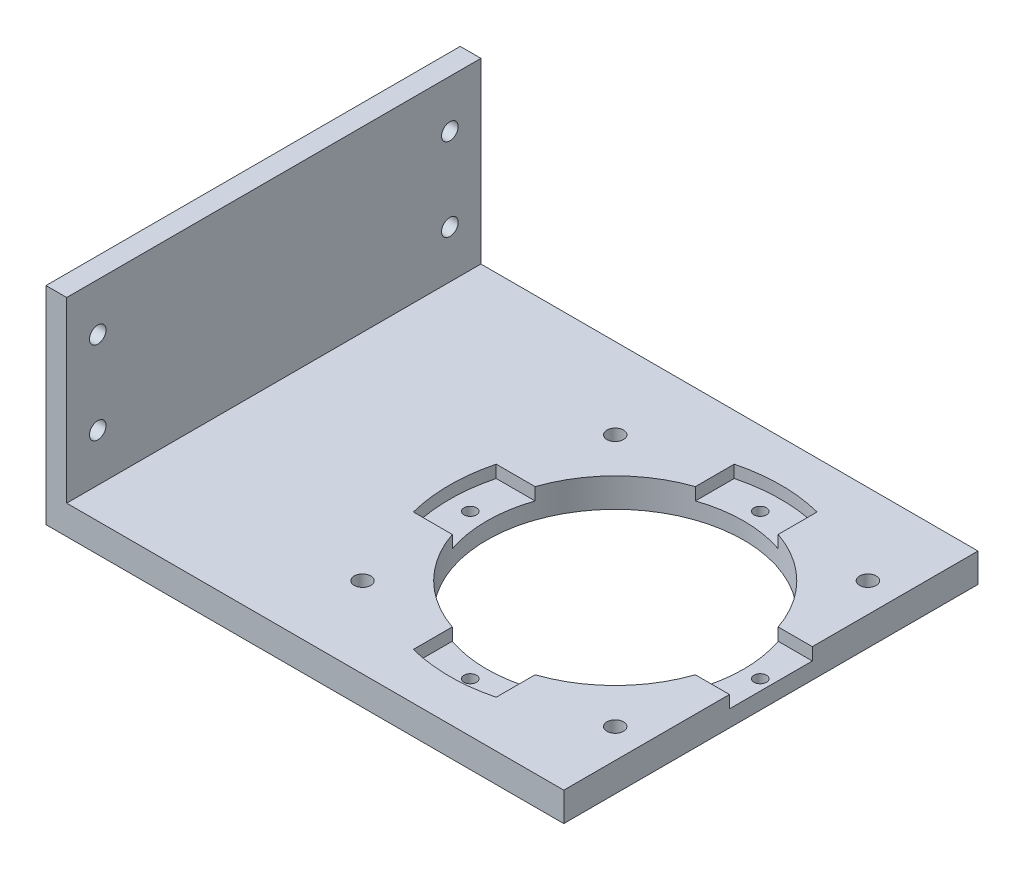
from build123d import *

# Parameters (mm, degrees)
BOSS_EXTRUDE1_DEPTH = 100
CUT_EXTRUDE1_REACH  = 167.753
SKETCH2_R           = 31
SKETCH2_R_2         = 2
CUT_EXTRUDE2_REACH  = 166.012
SKETCH3_R           = 2
CUT_EXTRUDE3_DEPTH  = 3
CUT_EXTRUDE4_REACH  = 168.556
SKETCH6_R           = 1.5


with BuildPart() as part:
    # Sketch1 → Boss-Extrude1 (new body)
    with BuildSketch(Plane.XY):
        Polygon((0, 0), (125, 0), (125, 7), (5, 7), (5, 50), (0, 50), align=None)
    extrude(amount=BOSS_EXTRUDE1_DEPTH)

    # Sketch2 → Cut-Extrude1 (cut, up to next)
    with BuildSketch(Plane(origin=(0, 7, 0), x_dir=(1, 0, 0), z_dir=(0, 1, 0)), mode=Mode.PRIVATE) as cut_extrude1_sk1:
        with Locations(Location((87.42, -50, 0), (0, 0, 180))):
            Circle(SKETCH2_R)
    cut_extrude1_tool1 = extrude(cut_extrude1_sk1.sketch, amount=-CUT_EXTRUDE1_REACH, mode=Mode.PRIVATE) & part.part
    # Sketch2 → Cut-Extrude1 (cut, up to next)
    with BuildSketch(Plane(origin=(0, 7, 0), x_dir=(1, 0, 0), z_dir=(0, 1, 0)), mode=Mode.PRIVATE) as cut_extrude1_sk2:
        with Locations(Location((56.92, -19.5, 0), (0, 0, 180))):
            Circle(SKETCH2_R_2)
    cut_extrude1_tool2 = extrude(cut_extrude1_sk2.sketch, amount=-CUT_EXTRUDE1_REACH, mode=Mode.PRIVATE) & part.part
    # Sketch2 → Cut-Extrude1 (cut, up to next)
    with BuildSketch(Plane(origin=(0, 7, 0), x_dir=(1, 0, 0), z_dir=(0, 1, 0)), mode=Mode.PRIVATE) as cut_extrude1_sk3:
        with Locations(Location((56.92, -80.5, 0), (0, 0, 270))):
            Circle(SKETCH2_R_2)
    cut_extrude1_tool3 = extrude(cut_extrude1_sk3.sketch, amount=-CUT_EXTRUDE1_REACH, mode=Mode.PRIVATE) & part.part
    # Sketch2 → Cut-Extrude1 (cut, up to next)
    with BuildSketch(Plane(origin=(0, 7, 0), x_dir=(1, 0, 0), z_dir=(0, 1, 0)), mode=Mode.PRIVATE) as cut_extrude1_sk4:
        with Locations(Location((117.92, -19.5, 0), (0, 0, 270))):
            Circle(SKETCH2_R_2)
    cut_extrude1_tool4 = extrude(cut_extrude1_sk4.sketch, amount=-CUT_EXTRUDE1_REACH, mode=Mode.PRIVATE) & part.part
    # Sketch2 → Cut-Extrude1 (cut, up to next)
    with BuildSketch(Plane(origin=(0, 7, 0), x_dir=(1, 0, 0), z_dir=(0, 1, 0)), mode=Mode.PRIVATE) as cut_extrude1_sk5:
        with Locations(Location((117.92, -80.5, 0), (0, 0, 180))):
            Circle(SKETCH2_R_2)
    cut_extrude1_tool5 = extrude(cut_extrude1_sk5.sketch, amount=-CUT_EXTRUDE1_REACH, mode=Mode.PRIVATE) & part.part
    add(cut_extrude1_tool1.solids().sort_by_distance((87.42, 7, 50))[0], mode=Mode.SUBTRACT)
    add(cut_extrude1_tool2.solids().sort_by_distance((56.92, 7, 19.5))[0], mode=Mode.SUBTRACT)
    add(cut_extrude1_tool3.solids().sort_by_distance((56.92, 7, 80.5))[0], mode=Mode.SUBTRACT)
    add(cut_extrude1_tool4.solids().sort_by_distance((117.92, 7, 19.5))[0], mode=Mode.SUBTRACT)
    add(cut_extrude1_tool5.solids().sort_by_distance((117.92, 7, 80.5))[0], mode=Mode.SUBTRACT)

    # Sketch3 → Cut-Extrude2 (cut, up to next)
    with BuildSketch(Plane(origin=(5, 0, 0), x_dir=(0, 0, -1), z_dir=(1, 0, 0)), mode=Mode.PRIVATE) as cut_extrude2_sk1:
        with Locations((-92.5, 38.5)):
            Circle(SKETCH3_R)
    cut_extrude2_tool1 = extrude(cut_extrude2_sk1.sketch, amount=-CUT_EXTRUDE2_REACH, mode=Mode.PRIVATE) & part.part
    # Sketch3 → Cut-Extrude2 (cut, up to next)
    with BuildSketch(Plane(origin=(5, 0, 0), x_dir=(0, 0, -1), z_dir=(1, 0, 0)), mode=Mode.PRIVATE) as cut_extrude2_sk2:
        with Locations(Location((-92.5, 18.5, 0), (0, 0, 90))):
            Circle(SKETCH3_R)
    cut_extrude2_tool2 = extrude(cut_extrude2_sk2.sketch, amount=-CUT_EXTRUDE2_REACH, mode=Mode.PRIVATE) & part.part
    # Sketch3 → Cut-Extrude2 (cut, up to next)
    with BuildSketch(Plane(origin=(5, 0, 0), x_dir=(0, 0, -1), z_dir=(1, 0, 0)), mode=Mode.PRIVATE) as cut_extrude2_sk3:
        with Locations(Location((-7.5, 38.5, 0), (0, 0, 90))):
            Circle(SKETCH3_R)
    cut_extrude2_tool3 = extrude(cut_extrude2_sk3.sketch, amount=-CUT_EXTRUDE2_REACH, mode=Mode.PRIVATE) & part.part
    # Sketch3 → Cut-Extrude2 (cut, up to next)
    with BuildSketch(Plane(origin=(5, 0, 0), x_dir=(0, 0, -1), z_dir=(1, 0, 0)), mode=Mode.PRIVATE) as cut_extrude2_sk4:
        with Locations((-7.5, 18.5)):
            Circle(SKETCH3_R)
    cut_extrude2_tool4 = extrude(cut_extrude2_sk4.sketch, amount=-CUT_EXTRUDE2_REACH, mode=Mode.PRIVATE) & part.part
    add(cut_extrude2_tool1.solids().sort_by_distance((5, 38.5, 92.5))[0], mode=Mode.SUBTRACT)
    add(cut_extrude2_tool2.solids().sort_by_distance((5, 18.5, 92.5))[0], mode=Mode.SUBTRACT)
    add(cut_extrude2_tool3.solids().sort_by_distance((5, 38.5, 7.5))[0], mode=Mode.SUBTRACT)
    add(cut_extrude2_tool4.solids().sort_by_distance((5, 18.5, 7.5))[0], mode=Mode.SUBTRACT)

    # Sketch4 → Cut-Extrude3 (cut)
    with BuildSketch(Plane(origin=(0, 7, 0), x_dir=(1, 0, 0), z_dir=(0, 1, 0))):
        with BuildLine():
            Line((97.42, -20.657198498), (97.42, -11.270166538))
            ThreePointArc((97.42, -11.270166538), (87.42, -10), (77.42, -11.270166538))
            Line((77.42, -11.270166538), (77.42, -20.657198498))
            ThreePointArc((77.42, -20.657198498), (87.42, -19), (97.42, -20.657198498))
        make_face()
        with BuildLine():
            Line((116.762801502, -60), (126.149833462, -60))
            ThreePointArc((126.149833462, -60), (127.42, -50), (126.149833462, -40))
            Line((126.149833462, -40), (116.762801502, -40))
            ThreePointArc((116.762801502, -40), (118.42, -50), (116.762801502, -60))
        make_face()
        with BuildLine():
            Line((77.42, -79.342801502), (77.42, -88.729833462))
            ThreePointArc((77.42, -88.729833462), (87.42, -90), (97.42, -88.729833462))
            Line((97.42, -88.729833462), (97.42, -79.342801502))
            ThreePointArc((97.42, -79.342801502), (87.42, -81), (77.42, -79.342801502))
        make_face()
        with BuildLine():
            Line((58.077198498, -40), (48.690166538, -40))
            ThreePointArc((48.690166538, -40), (47.42, -50), (48.690166538, -60))
            Line((48.690166538, -60), (58.077198498, -60))
            ThreePointArc((58.077198498, -60), (56.42, -50), (58.077198498, -40))
        make_face()
    extrude(amount=-CUT_EXTRUDE3_DEPTH, mode=Mode.SUBTRACT)

    # Sketch6 → Cut-Extrude4 (cut, up to next)
    with BuildSketch(Plane(origin=(0, 4, 0), x_dir=(1, 0, 0), z_dir=(0, 1, 0)), mode=Mode.PRIVATE) as cut_extrude4_sk1:
        with Locations(Location((87.42, -15, 0), (0, 0, 180))):
            Circle(SKETCH6_R)
    cut_extrude4_tool1 = extrude(cut_extrude4_sk1.sketch, amount=-CUT_EXTRUDE4_REACH, mode=Mode.PRIVATE) & part.part
    # Sketch6 → Cut-Extrude4 (cut, up to next)
    with BuildSketch(Plane(origin=(0, 4, 0), x_dir=(1, 0, 0), z_dir=(0, 1, 0)), mode=Mode.PRIVATE) as cut_extrude4_sk2:
        with Locations(Location((122.42, -50, 0), (0, 0, 180))):
            Circle(SKETCH6_R)
    cut_extrude4_tool2 = extrude(cut_extrude4_sk2.sketch, amount=-CUT_EXTRUDE4_REACH, mode=Mode.PRIVATE) & part.part
    # Sketch6 → Cut-Extrude4 (cut, up to next)
    with BuildSketch(Plane(origin=(0, 4, 0), x_dir=(1, 0, 0), z_dir=(0, 1, 0)), mode=Mode.PRIVATE) as cut_extrude4_sk3:
        with Locations(Location((87.42, -85, 0), (0, 0, 180))):
            Circle(SKETCH6_R)
    cut_extrude4_tool3 = extrude(cut_extrude4_sk3.sketch, amount=-CUT_EXTRUDE4_REACH, mode=Mode.PRIVATE) & part.part
    # Sketch6 → Cut-Extrude4 (cut, up to next)
    with BuildSketch(Plane(origin=(0, 4, 0), x_dir=(1, 0, 0), z_dir=(0, 1, 0)), mode=Mode.PRIVATE) as cut_extrude4_sk4:
        with Locations(Location((52.42, -50, 0), (0, 0, 180))):
            Circle(SKETCH6_R)
    cut_extrude4_tool4 = extrude(cut_extrude4_sk4.sketch, amount=-CUT_EXTRUDE4_REACH, mode=Mode.PRIVATE) & part.part
    add(cut_extrude4_tool1.solids().sort_by_distance((87.42, 4, 15))[0], mode=Mode.SUBTRACT)
    add(cut_extrude4_tool2.solids().sort_by_distance((122.42, 4, 50))[0], mode=Mode.SUBTRACT)
    add(cut_extrude4_tool3.solids().sort_by_distance((87.42, 4, 85))[0], mode=Mode.SUBTRACT)
    add(cut_extrude4_tool4.solids().sort_by_distance((52.42, 4, 50))[0], mode=Mode.SUBTRACT)


solid = part.part
